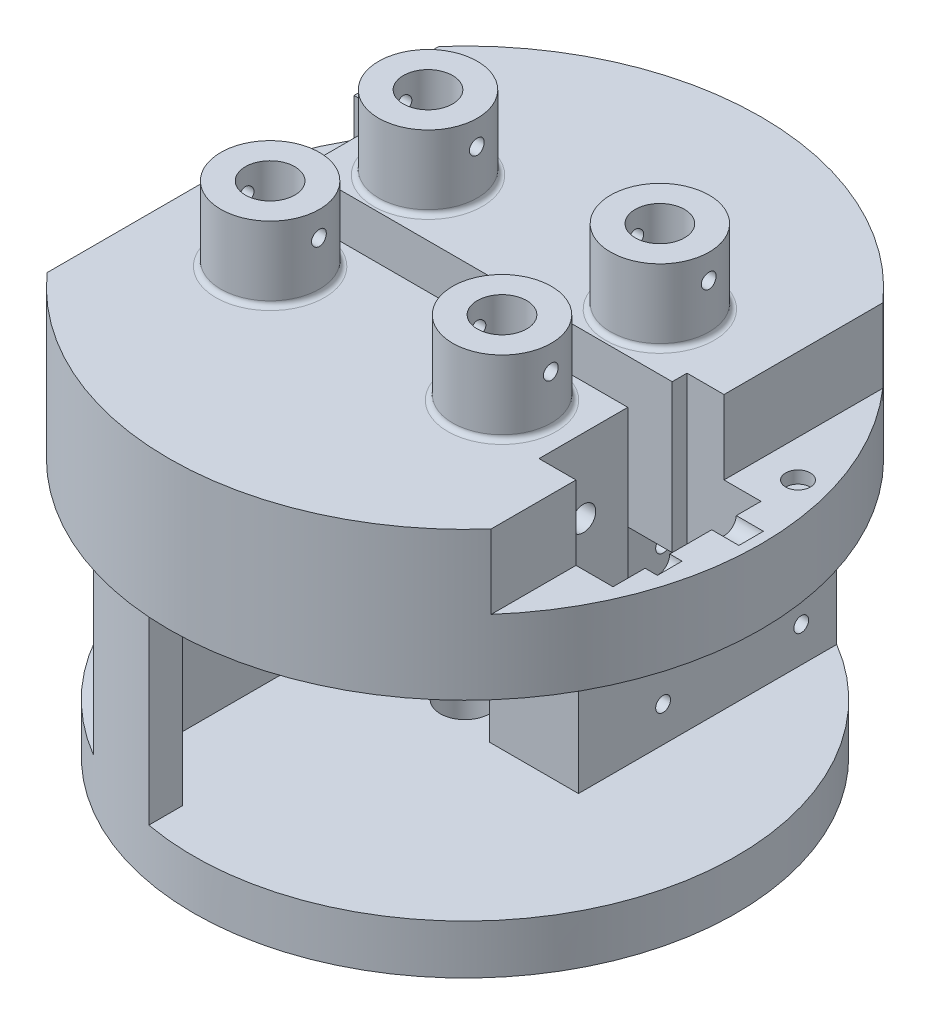
from build123d import *

# Parameters (mm, degrees)
SKETCH1_R                = 55
BOSS_EXTRUDE1_DEPTH      = 10
BOSS_EXTRUDE5_DEPTH      = 42.3
SKETCH6_R                = 1.5
CUT_EXTRUDE1_DEPTH       = 113.469062413
CIRPATTERN1_COUNT        = 2
SKETCH3_R                = 60
BOSS_EXTRUDE4_DEPTH      = 30
SKETCH4_R                = 10
SKETCH4_R_2              = 5
BOSS_EXTRUDE6_DEPTH      = 15
FILLET1_R                = 1
CUT_EXTRUDE2_DEPTH       = 130.101859011
CUT_EXTRUDE2_DEPTH_BACK  = 130.101859011
SKETCH7_R                = 1.5
SKETCH9_W                = 75
SKETCH9_H                = 9
SKETCH9_W_2              = 7.5
CUT_EXTRUDE6_DEPTH       = 30
SKETCH11_W               = 18
SKETCH11_H               = 42.3
BOSS_EXTRUDE7_DEPTH      = 5
SKETCH14_W               = 18
SKETCH14_H               = 42.3
BOSS_EXTRUDE8_DEPTH      = 5
SKETCH18_W               = 18
SKETCH18_H               = 9
BOSS_EXTRUDE9_DEPTH      = 15
CUT_EXTRUDE7_START       = -5
SKETCH19_R               = 2.5
CUT_EXTRUDE7_DEPTH       = 35
SKETCH20_R               = 2.5
CUT_EXTRUDE8_REACH       = 120.209
SKETCH22_W               = 15
SKETCH22_H               = 15
CUT_EXTRUDE9_DEPTH       = 17.5
CUT_EXTRUDE9_DEPTH_BACK  = 5
SKETCH24_R               = 2.5
CUT_EXTRUDE10_DEPTH      = 17.5
CUT_EXTRUDE10_DEPTH_BACK = 5
SKETCH25_R               = 2.5
CUT_EXTRUDE11_START      = -15
CUT_EXTRUDE11_DEPTH      = 15
SKETCH27_R               = 2.5
CUT_EXTRUDE12_DEPTH      = 2.5
CUT_EXTRUDE13_REACH      = 131.102
SKETCH28_R               = 5


with BuildPart() as part:
    # Sketch1 → Boss-Extrude1 (new body)
    with BuildSketch(Plane(origin=(0, 0, 0), x_dir=(1, 0, 0), z_dir=(0, 1, 0))):
        with Locations(Location((0, 0, 0), (0, 0, 270))):
            Circle(SKETCH1_R)
    extrude(amount=BOSS_EXTRUDE1_DEPTH)

    # Sketch5 → Boss-Extrude5 (add)
    with BuildSketch(Plane(origin=(0, 10, 0), x_dir=(1, 0, 0), z_dir=(0, 1, 0))):
        with BuildLine():
            Line((-10, -54.083269132), (-10, -47.3))
            Line((-10, -47.3), (-23, -47.3))
            Line((-23, -47.3), (-23, -5))
            Line((-23, -5), (-10, -5))
            Line((-10, -5), (-10, 0))
            Line((-10, 0), (-28, 0))
            Line((-28, 0), (-28, -47.339201514))
            ThreePointArc((-28, -47.339201514), (-19.296906799, -51.503683247), (-10, -54.083269132))
        make_face()
        with BuildLine():
            Line((10, 5), (10, 0))
            Line((10, 0), (28, 0))
            Line((28, 0), (28, 47.339201514))
            ThreePointArc((28, 47.339201514), (19.296906799, 51.503683247), (10, 54.083269132))
            Line((10, 54.083269132), (10, 47.3))
            Line((10, 47.3), (23, 47.3))
            Line((23, 47.3), (23, 5))
            Line((23, 5), (10, 5))
        make_face()
    extrude(amount=BOSS_EXTRUDE5_DEPTH)

    # Sketch6 → Cut-Extrude1 (cut, through all)
    with BuildSketch(Plane(origin=(28, 0, 0), x_dir=(0, 0, -1), z_dir=(1, 0, 0))):
        with Locations((12.15, 45.15)):
            Circle(SKETCH6_R)
        with Locations((40.15, 45.15)):
            Circle(SKETCH6_R)
        with Locations((40.15, 17.15)):
            Circle(SKETCH6_R)
        with Locations((12.15, 17.15)):
            Circle(SKETCH6_R)
    cut_extrude1 = extrude(amount=-CUT_EXTRUDE1_DEPTH, mode=Mode.SUBTRACT)

    # CirPattern1: Cut-Extrude1 ×2 about axis
    cirpattern1_axis = Axis((0, 10, 0), (0, 1, 0))
    for i in range(1, CIRPATTERN1_COUNT):
        add(cut_extrude1.rotate(cirpattern1_axis, i * 360 / CIRPATTERN1_COUNT), mode=Mode.SUBTRACT)

    # Sketch3 → Boss-Extrude4 (add)
    with BuildSketch(Plane(origin=(0, 52.3, 0), x_dir=(1, 0, 0), z_dir=(0, 1, 0))):
        with Locations(Location((0, 0, 0), (0, 0, 270))):
            Circle(SKETCH3_R)
    extrude(amount=BOSS_EXTRUDE4_DEPTH)

    # Sketch4 → Boss-Extrude6 (add)
    # profile 1 of 4: a face of its own
    with BuildSketch(Plane(origin=(0, 82.3, 0), x_dir=(1, 0, 0), z_dir=(0, 1, 0))):
        with Locations(Location((-23.5, 16, 0), (0, 0, 270))):
            Circle(SKETCH4_R)
        with Locations(Location((-23.5, 16, 0), (0, 0, 270))):
            Circle(SKETCH4_R_2, mode=Mode.SUBTRACT)
    # profile 2 of 4: a face of its own
    with BuildSketch(Plane(origin=(0, 82.3, 0), x_dir=(1, 0, 0), z_dir=(0, 1, 0))):
        with Locations(Location((23.5, 16, 0), (0, 0, 270))):
            Circle(SKETCH4_R)
        with Locations(Location((23.5, 16, 0), (0, 0, 270))):
            Circle(SKETCH4_R_2, mode=Mode.SUBTRACT)
    # profile 3 of 4: a face of its own
    with BuildSketch(Plane(origin=(0, 82.3, 0), x_dir=(1, 0, 0), z_dir=(0, 1, 0))):
        with Locations(Location((23.5, -16, 0), (0, 0, 270))):
            Circle(SKETCH4_R)
        with Locations(Location((23.5, -16, 0), (0, 0, 270))):
            Circle(SKETCH4_R_2, mode=Mode.SUBTRACT)
    # profile 4 of 4: a face of its own
    with BuildSketch(Plane(origin=(0, 82.3, 0), x_dir=(1, 0, 0), z_dir=(0, 1, 0))):
        with Locations(Location((-23.5, -16, 0), (0, 0, 270))):
            Circle(SKETCH4_R)
        with Locations(Location((-23.5, -16, 0), (0, 0, 270))):
            Circle(SKETCH4_R_2, mode=Mode.SUBTRACT)
    extrude(amount=BOSS_EXTRUDE6_DEPTH)

    # Fillet1
    fillet1_edges = [part.edges().sort_by_distance(p)[0] for p in [
        (-23.5, 82.3, 6),
        (23.5, 82.3, 6),
        (23.5, 82.3, -26),
        (-23.5, 82.3, -26),
    ]]
    fillet(fillet1_edges, radius=FILLET1_R)

    # Sketch7 → Cut-Extrude2 (cut, two sides: drawn at the far end of the back side and taken through both)
    with BuildSketch(Plane(origin=(0, 0, 0), x_dir=(0, 0, -1), z_dir=(1, 0, 0)).offset(-CUT_EXTRUDE2_DEPTH_BACK)):
        with Locations(Location((16, 92.3, 0), (0, 0, 180))):
            Circle(SKETCH7_R)
        with Locations(Location((-16, 92.3, 0), (0, 0, 180))):
            Circle(SKETCH7_R)
    extrude(amount=CUT_EXTRUDE2_DEPTH + CUT_EXTRUDE2_DEPTH_BACK, mode=Mode.SUBTRACT)

    # Sketch9 → Cut-Extrude6 (cut)
    with BuildSketch(Plane(origin=(0, 82.3, 0), x_dir=(1, 0, 0), z_dir=(0, 1, 0))):
        Polygon((-45, -4.5), (-45, 4.5), (-37.5, 4.5), (-37.5, 7.5), (-52.5, 7.5), (-52.5, -7.5), (-37.5, -7.5), (-37.5, -4.5), align=None)
        Rectangle(SKETCH9_W, SKETCH9_H)
        with Locations((-41.25, 0)):
            Rectangle(SKETCH9_W_2, SKETCH9_H)
        with Locations((41.25, 0)):
            Rectangle(SKETCH9_W_2, SKETCH9_H)
        Polygon((37.5, 7.5), (37.5, 4.5), (45, 4.5), (45, -4.5), (37.5, -4.5), (37.5, -7.5), (52.5, -7.5), (52.5, 7.5), align=None)
    extrude(amount=-CUT_EXTRUDE6_DEPTH, mode=Mode.SUBTRACT)

    # Sketch11 → Boss-Extrude7 (add)
    with BuildSketch(Plane(origin=(0, 0, 0), x_dir=(-1, 0, 0), z_dir=(0, 0, -1))):
        with Locations((19, 31.15)):
            Rectangle(SKETCH11_W, SKETCH11_H)
    extrude(amount=BOSS_EXTRUDE7_DEPTH)

    # Sketch14 → Boss-Extrude8 (add)
    with BuildSketch(Plane.XY):
        with Locations((19, 31.15)):
            Rectangle(SKETCH14_W, SKETCH14_H)
    extrude(amount=BOSS_EXTRUDE8_DEPTH)

    # Sketch18 → Boss-Extrude9 (add)
    with BuildSketch(Plane(origin=(0, 52.3, 0), x_dir=(1, 0, 0), z_dir=(0, 1, 0))):
        with Locations((-19, 0)):
            Rectangle(SKETCH18_W, SKETCH18_H)
        with Locations((19, 0)):
            Rectangle(SKETCH18_W, SKETCH18_H)
    extrude(amount=BOSS_EXTRUDE9_DEPTH)

    # Sketch19 → Cut-Extrude7 (cut)
    with BuildSketch(Plane.ZY.offset(28).offset(CUT_EXTRUDE7_START)):
        with Locations((0, 67.5)):
            Circle(SKETCH19_R)
    cut_extrude7 = extrude(amount=CUT_EXTRUDE7_DEPTH, mode=Mode.SUBTRACT)

    # Mirror1: Cut-Extrude7 across plane
    add(cut_extrude7.mirror(Plane(origin=(0, 0, 0), x_dir=(0, 0, 1), z_dir=(1, 0, 0))), mode=Mode.SUBTRACT)

    # Cut-Sweep1: sweep along a path in Sketch21
    with BuildLine(Plane.XZ) as cut_sweep1_path:
        CenterArc((0, 0), 50, 0, 360)
    # Sketch20 → Cut-Sweep1 (sweep, cut)
    with BuildSketch(Plane(origin=(0, 0, 0), x_dir=(0, 0, -1), z_dir=(1, 0, 0))):
        with Locations((-50, 0)):
            Circle(SKETCH20_R)
    sweep(path=cut_sweep1_path.line, mode=Mode.SUBTRACT)

    # Sketch22 → Cut-Extrude8 (cut, up to next)
    with BuildSketch(Plane(origin=(0, 82.3, 0), x_dir=(1, 0, 0), z_dir=(0, 1, 0)), mode=Mode.PRIVATE) as cut_extrude8_sk1:
        with Locations((-45, 15)):
            Rectangle(SKETCH22_W, SKETCH22_H)
    cut_extrude8_tool1 = extrude(cut_extrude8_sk1.sketch, amount=-CUT_EXTRUDE8_REACH, mode=Mode.PRIVATE) & part.part
    # Sketch22 → Cut-Extrude8 (cut, up to next)
    with BuildSketch(Plane(origin=(0, 82.3, 0), x_dir=(1, 0, 0), z_dir=(0, 1, 0)), mode=Mode.PRIVATE) as cut_extrude8_sk2:
        with Locations((45, -15)):
            Rectangle(SKETCH22_W, SKETCH22_H)
    cut_extrude8_tool2 = extrude(cut_extrude8_sk2.sketch, amount=-CUT_EXTRUDE8_REACH, mode=Mode.PRIVATE) & part.part
    add(cut_extrude8_tool1.solids().sort_by_distance((-45, 82.3, -15))[0], mode=Mode.SUBTRACT)
    add(cut_extrude8_tool2.solids().sort_by_distance((45, 82.3, 15))[0], mode=Mode.SUBTRACT)

    # Sketch24 → Cut-Extrude9 (cut, two sides: drawn at the far end of the back side and taken through both)
    with BuildSketch(Plane.ZY.offset(37.5).offset(-CUT_EXTRUDE9_DEPTH_BACK)):
        with Locations((-13.5, 67.3)):
            Circle(SKETCH24_R)
    extrude(amount=CUT_EXTRUDE9_DEPTH + CUT_EXTRUDE9_DEPTH_BACK, mode=Mode.SUBTRACT)

    # Sketch25 → Cut-Extrude10 (cut, two sides: drawn at the far end of the back side and taken through both)
    with BuildSketch(Plane(origin=(37.5, 0, 0), x_dir=(0, 0, -1), z_dir=(1, 0, 0)).offset(-CUT_EXTRUDE10_DEPTH_BACK)):
        with Locations((-13.5, 67.3)):
            Circle(SKETCH25_R)
    extrude(amount=CUT_EXTRUDE10_DEPTH + CUT_EXTRUDE10_DEPTH_BACK, mode=Mode.SUBTRACT)

    # Sketch26 → Cut-Extrude11 (cut)
    with BuildSketch(Plane(origin=(0, 82.3, 0), x_dir=(1, 0, 0), z_dir=(0, 1, 0)).offset(CUT_EXTRUDE11_START)):
        with BuildLine():
            Line((45, 7.5), (45, 39.686269666))
            ThreePointArc((45, 39.686269666), (60, 0), (45, -39.686269666))
            Line((45, -39.686269666), (45, -22.5))
            Line((45, -22.5), (52.5, -22.5))
            Line((52.5, -22.5), (52.5, 7.5))
            Line((52.5, 7.5), (45, 7.5))
        make_face()
        with BuildLine():
            Line((-52.5, 22.5), (-45, 22.5))
            Line((-45, 22.5), (-45, 39.686269666))
            ThreePointArc((-45, 39.686269666), (-60, 0), (-45, -39.686269666))
            Line((-45, -39.686269666), (-45, -7.5))
            Line((-45, -7.5), (-52.5, -7.5))
            Line((-52.5, -7.5), (-52.5, 22.5))
        make_face()
    extrude(amount=CUT_EXTRUDE11_DEPTH, mode=Mode.SUBTRACT)

    # Sketch27 → Cut-Extrude12 (cut)
    with BuildSketch(Plane(origin=(0, 67.3, 0), x_dir=(1, 0, 0), z_dir=(0, 1, 0))):
        with Locations(Location((-52.5, -15, 0), (0, 0, 270))):
            Circle(SKETCH27_R)
        with Locations(Location((52.5, 15, 0), (0, 0, 270))):
            Circle(SKETCH27_R)
    extrude(amount=-CUT_EXTRUDE12_DEPTH, mode=Mode.SUBTRACT)

    # Sketch28 → Cut-Extrude13 (cut, up to next)
    with BuildSketch(Plane.XZ, mode=Mode.PRIVATE) as cut_extrude13_sk1:
        with Locations(Location((0, 0, 0), (0, 0, 270))):
            Circle(SKETCH28_R)
    cut_extrude13_tool1 = extrude(cut_extrude13_sk1.sketch, amount=-CUT_EXTRUDE13_REACH, mode=Mode.PRIVATE) & part.part
    add(cut_extrude13_tool1.solids().sort_by_distance((0, 0, 0))[0], mode=Mode.SUBTRACT)


solid = part.part
